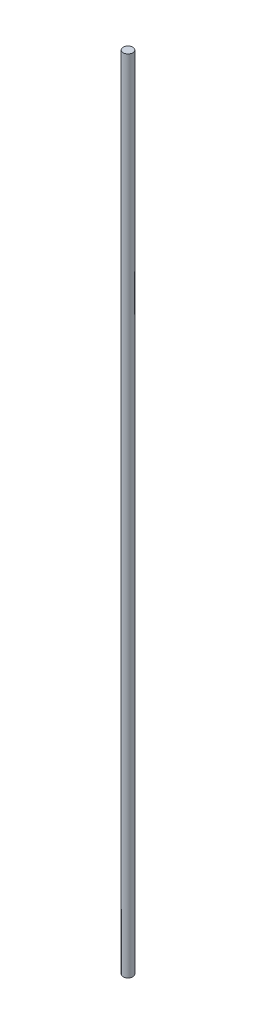
from build123d import *

# Parameters (mm, degrees)
SKETCH1_W = 3
SKETCH1_H = 495


with BuildPart() as part:
    # Sketch1 → Revolve1 (revolve)
    with BuildSketch(Plane(origin=(0, 0, 0), x_dir=(0, 0, -1), z_dir=(1, 0, 0))):
        with Locations((1.5, 244.994769148)):
            Rectangle(SKETCH1_W, SKETCH1_H)
    revolve(axis=Axis((0, 492.494769148, -3), (0, -1, 0)))


solid = part.part
